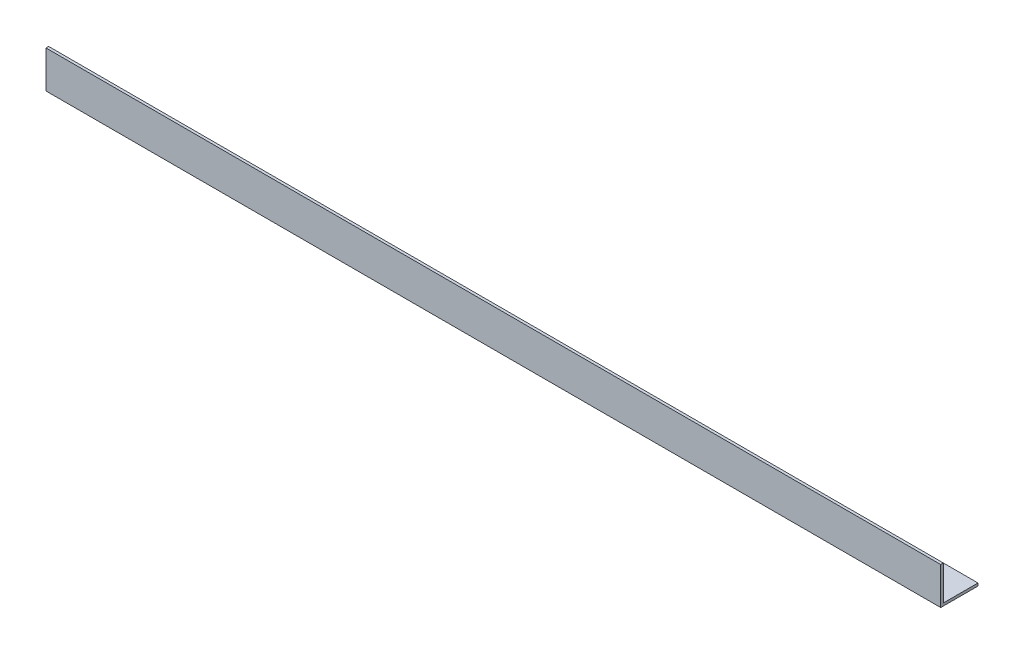
from build123d import *

# Parameters (mm, degrees)
BOSS_EXTRUDE1_DEPTH = 1066.8
SKETCH2_R           = 2.45745
CUT_EXTRUDE1_DEPTH  = 889


with BuildPart() as part:
    # Sketch1 → Boss-Extrude1 (new body)
    with BuildSketch(Plane(origin=(0, 0, 0), x_dir=(0, 0, -1), z_dir=(1, 0, 0))):
        Polygon((0, 0), (0, 44.45), (3.175, 44.45), (3.175, 3.175), (44.45, 3.175), (44.45, 0), align=None)
    extrude(amount=BOSS_EXTRUDE1_DEPTH)

    # Sketch2 → Cut-Extrude1 (cut)
    with BuildSketch(Plane(origin=(0, 3.175, 0), x_dir=(1, 0, 0), z_dir=(0, 1, 0))):
        with Locations(Location((120.65, 22.225, 0), (0, 0, 270))):
            Circle(SKETCH2_R)
        with Locations(Location((395.81582, 22.225, 0), (0, 0, 270))):
            Circle(SKETCH2_R)
        with Locations(Location((670.98418, 22.225, 0), (0, 0, 270))):
            Circle(SKETCH2_R)
        with Locations(Location((946.15, 22.225, 0), (0, 0, 270))):
            Circle(SKETCH2_R)
    extrude(amount=-CUT_EXTRUDE1_DEPTH, mode=Mode.SUBTRACT)


solid = part.part
